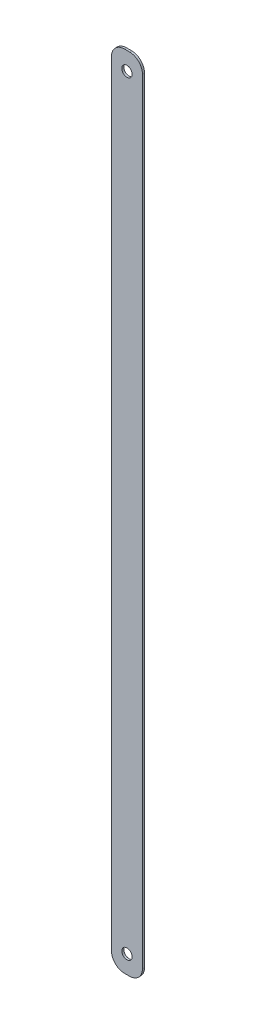
from build123d import *

# Parameters (mm, degrees)
CROQUIS1_R              = 2
SALIENTE_EXTRUIR1_DEPTH = 0.4


with BuildPart() as part:
    # Croquis1 → Saliente-Extruir1 (new, symmetric)
    with BuildSketch(Plane.XY):
        with BuildLine():
            Line((-1, -155), (1, -155))
            ThreePointArc((1, -155), (4.535533906, -153.535533906), (6, -150))
            Line((6, -150), (6, 150))
            ThreePointArc((6, 150), (4.535533906, 153.535533906), (1, 155))
            Line((1, 155), (-1, 155))
            ThreePointArc((-1, 155), (-4.535533906, 153.535533906), (-6, 150))
            Line((-6, 150), (-6, -150))
            ThreePointArc((-6, -150), (-4.535533906, -153.535533906), (-1, -155))
        make_face()
        with Locations((0, 148)):
            Circle(CROQUIS1_R, mode=Mode.SUBTRACT)
        with Locations(Location((0, -148, 0), (0, 0, 180))):
            Circle(CROQUIS1_R, mode=Mode.SUBTRACT)
    extrude(amount=SALIENTE_EXTRUIR1_DEPTH, both=True)


solid = part.part
